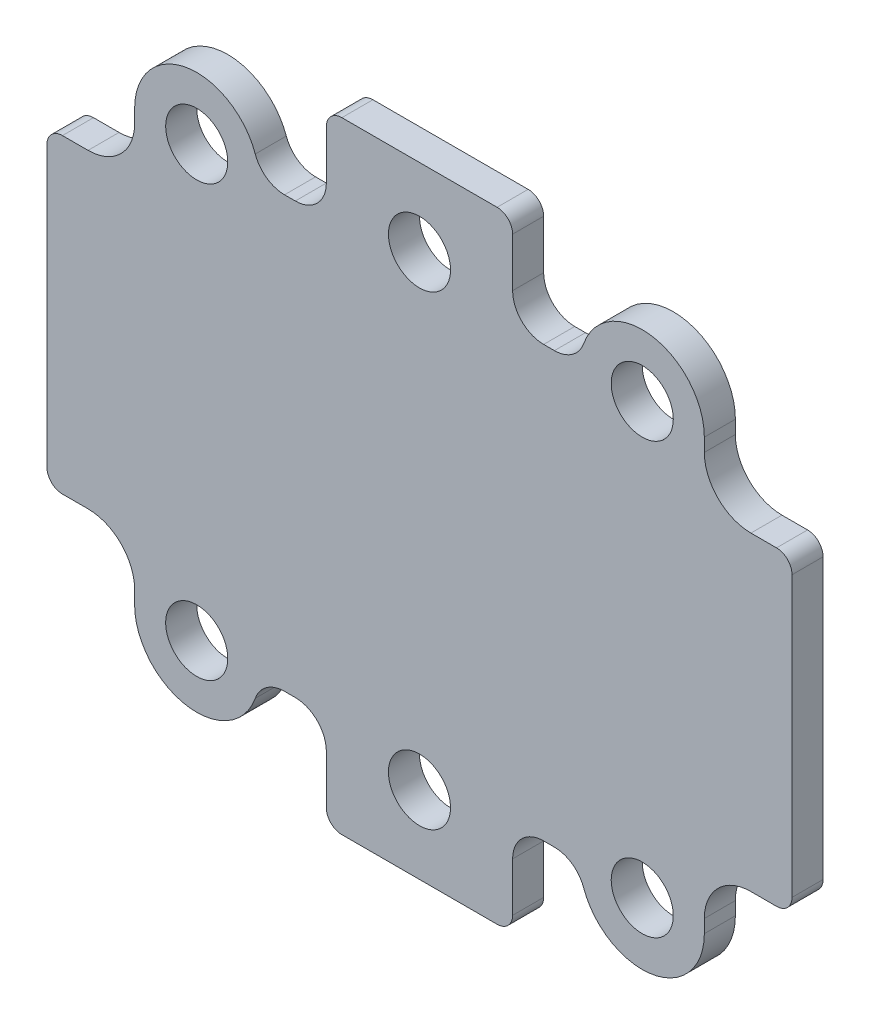
from build123d import *

# Parameters (mm, degrees)
SKETCH_1_R      = 2
EXTRUDE_1_DEPTH = 2
FILLET_1_R      = 3
FILLET_2_R      = 1


with BuildPart() as part:
    # ｽｹｯﾁ1 → ﾎﾞｽ - 押し出し1 (new body)
    with BuildSketch(Plane.XY):
        with BuildLine():
            Line((0, 0), (12, 0))
            Line((12, 0), (12, -4.15))
            ThreePointArc((12, -4.15), (12.585786438, -5.564213562), (14, -6.15))
            Line((14, -6.15), (14.693145751, -6.15))
            ThreePointArc((14.693145751, -6.15), (15.847846289, -5.782993162), (16.578763834, -4.816666667))
            ThreePointArc((16.578763834, -4.816666667), (21.026407915, -2.207605761), (24.35, -6.15))
            Line((24.35, -6.15), (24.35, -10))
            Line((24.35, -10), (30, -10))
            Line((30, -10), (30, -30))
            Line((30, -30), (24.35, -30))
            Line((24.35, -30), (24.35, -33.85))
            ThreePointArc((24.35, -33.85), (21.026407915, -37.792394239), (16.578763834, -35.183333333))
            ThreePointArc((16.578763834, -35.183333333), (15.847846289, -34.217006838), (14.693145751, -33.85))
            Line((14.693145751, -33.85), (14, -33.85))
            ThreePointArc((14, -33.85), (12.585786438, -34.435786438), (12, -35.85))
            Line((12, -35.85), (12, -40))
            Line((12, -40), (0, -40))
            Line((0, -40), (0, -35.85))
            ThreePointArc((0, -35.85), (-0.585786438, -34.435786438), (-2, -33.85))
            Line((-2, -33.85), (-2.693145751, -33.85))
            ThreePointArc((-2.693145751, -33.85), (-3.847846289, -34.217006838), (-4.578763834, -35.183333333))
            ThreePointArc((-4.578763834, -35.183333333), (-9.026407915, -37.792394239), (-12.35, -33.85))
            Line((-12.35, -33.85), (-12.35, -30))
            Line((-12.35, -30), (-18, -30))
            Line((-18, -30), (-18, -10))
            Line((-18, -10), (-12.35, -10))
            Line((-12.35, -10), (-12.35, -6.15))
            ThreePointArc((-12.35, -6.15), (-9.026407915, -2.207605761), (-4.578763834, -4.816666667))
            ThreePointArc((-4.578763834, -4.816666667), (-3.847846289, -5.782993162), (-2.693145751, -6.15))
            Line((-2.693145751, -6.15), (-2, -6.15))
            ThreePointArc((-2, -6.15), (-0.585786438, -5.564213562), (0, -4.15))
            Line((0, -4.15), (0, 0))
        make_face()
        with Locations((20.35, -6.15)):
            Circle(SKETCH_1_R, mode=Mode.SUBTRACT)
        with Locations(Location((-8.35, -6.15, 0), (0, 0, 180))):
            Circle(SKETCH_1_R, mode=Mode.SUBTRACT)
        with Locations(Location((20.35, -33.85, 0), (0, 0, 180))):
            Circle(SKETCH_1_R, mode=Mode.SUBTRACT)
        with Locations((-8.35, -33.85)):
            Circle(SKETCH_1_R, mode=Mode.SUBTRACT)
        with Locations((6, -5)):
            Circle(SKETCH_1_R, mode=Mode.SUBTRACT)
        with Locations(Location((6, -35, 0), (0, 0, 180))):
            Circle(SKETCH_1_R, mode=Mode.SUBTRACT)
    extrude(amount=EXTRUDE_1_DEPTH)

    # ﾌｨﾚｯﾄ1
    fillet_1_edges = [part.edges().sort_by_distance(p)[0] for p in [
        (24.35, -10, 1),
        (24.35, -30, 1),
        (-12.35, -30, 1),
        (-12.35, -10, 1),
    ]]
    fillet(fillet_1_edges, radius=FILLET_1_R)

    # ﾌｨﾚｯﾄ2
    fillet_2_edges = [part.edges().sort_by_distance(p)[0] for p in [
        (0, 0, 1),
        (12, 0, 1),
        (30, -10, 1),
        (30, -30, 1),
        (12, -40, 1),
        (0, -40, 1),
        (-18, -30, 1),
        (-18, -10, 1),
    ]]
    fillet(fillet_2_edges, radius=FILLET_2_R)


solid = part.part
